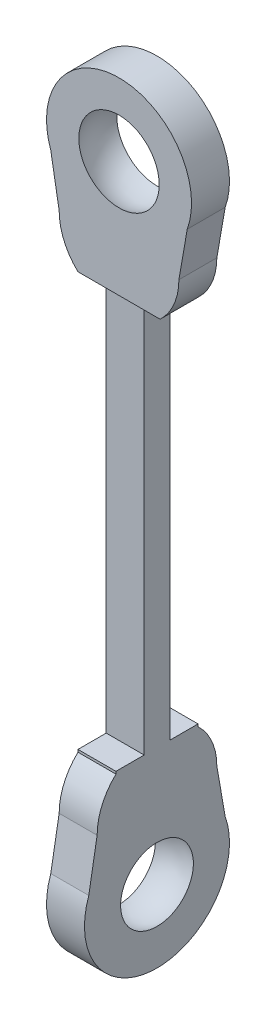
from build123d import *

# Parameters (mm, degrees)
SKETCH_1_R               = 3.532
SKETCH_1_R_2             = 2.165
EXTRUDE_1_DEPTH          = 2.849
EXTRUDE_START            = -2.849
EXTRUDE_3_DEPTH          = 2.849
EXTRUDE_4_DEPTH          = 2.849
SKETCH_5_W               = 4
SKETCH_5_H               = 8.802
EXTRUDE_5_DEPTH          = 2.849
EXTRUDE_6_DEPTH          = 2
EXTRUDE_6_DEPTH_BACK     = 2
SKETCH_11_R              = 2.165
SKETCH_12_W              = 1.376249561
SKETCH_12_H              = 19.360404774
SKETCH_12_W_2            = 1.095086679
CUT_EXTRUDE_1_DEPTH      = 24
CUT_EXTRUDE_2_DEPTH      = 24
CUT_EXTRUDE_2_DEPTH_BACK = 24
SKETCH_14_W              = 1.935032997
SKETCH_14_H              = 19.90949692
SKETCH_14_W_2            = 1.968594382
SKETCH_15_W              = 2.629097519
SKETCH_15_H              = 19.073490401
SKETCH_15_W_2            = 3.221303736
CUT_EXTRUDE_3_DEPTH      = 24
SKETCH_16_W              = 0.5
SKETCH_16_H              = 9.595959473
CUT_EXTRUDE_4_DEPTH      = 24
CUT_EXTRUDE_5_DEPTH      = 24
CUT_EXTRUDE_5_DEPTH_BACK = 24
SKETCH_17_W              = 1.075
SKETCH_17_H              = 30.344064149
SKETCH_19_R              = 2.165
EXTRUDE_7_DEPTH          = 1.849
SKETCH_21_R              = 2.165
EXTRUDE_9_DEPTH          = 1.85


with BuildPart() as part:
    # 草图1 → 凸台-拉伸1 (new body)
    with BuildSketch(Plane.XY):
        Circle(SKETCH_1_R)
        Circle(SKETCH_1_R_2, mode=Mode.SUBTRACT)
    extrude(amount=EXTRUDE_1_DEPTH)

    # 草图3 → 凸台-拉伸3 (add)
    with BuildSketch(Plane.XY.offset(2.849).offset(EXTRUDE_START)):
        with BuildLine():
            Line((-3.323475253, -1.195632151), (-2.916, -3.532))
            ThreePointArc((-2.916, -3.532), (0, -6.448), (2.916, -3.532))
            Line((2.916, -3.532), (3.323475253, -1.195632151))
            ThreePointArc((3.323475253, -1.195632151), (3.042882681, -1.79328999), (2.655959655, -2.328283126))
            ThreePointArc((2.655959655, -2.328283126), (-0.657357457, -3.470288918), (-3.323475253, -1.195632151))
        make_face()
    extrude(amount=EXTRUDE_3_DEPTH)

    # 草图4 → 凸台-拉伸4 (add)
    with BuildSketch(Plane.XY.offset(2.849).offset(EXTRUDE_START)):
        with BuildLine():
            ThreePointArc((2, -5.654040527), (1.075914918, -6.242251481), (0, -6.448))
            Line((0, -6.448), (2, -6.448))
            Line((2, -6.448), (2, -5.654040527))
        make_face()
        with BuildLine():
            Line((0, -6.448), (-2, -6.448))
            Line((-2, -6.448), (-2, -5.654040527))
            ThreePointArc((-2, -5.654040527), (-1.075914918, -6.242251481), (0, -6.448))
        make_face()
    extrude(amount=EXTRUDE_4_DEPTH)

    # 草图5 → 凸台-拉伸5 (add)
    with BuildSketch(Plane.XY.offset(2.849)):
        with Locations((0, -10.849)):
            Rectangle(SKETCH_5_W, SKETCH_5_H)
    extrude(amount=-EXTRUDE_5_DEPTH)

    # 草图11 → 凸台-拉伸6 (add, two sides: drawn at the far end of the back side and taken through both)
    with BuildSketch(Plane.ZY.offset(-EXTRUDE_6_DEPTH_BACK)):
        with BuildLine():
            Line((4.747975253, -29.304367849), (4.3405, -26.968))
            ThreePointArc((4.3405, -26.968), (4.101723935, -25.812349534), (3.4245, -24.845959473))
            Line((3.4245, -24.845959473), (3.4245, -15.25))
            Line((3.4245, -15.25), (-0.5755, -15.25))
            Line((-0.5755, -15.25), (-0.5755, -24.845959473))
            ThreePointArc((-0.5755, -24.845959473), (-1.252723935, -25.812349534), (-1.4915, -26.968))
            Line((-1.4915, -26.968), (-1.898975253, -29.304367849))
            ThreePointArc((-1.898975253, -29.304367849), (1.4245, -34.032), (4.747975253, -29.304367849))
        make_face()
        with Locations((1.4245, -30.5)):
            Circle(SKETCH_11_R, mode=Mode.SUBTRACT)
    extrude(amount=EXTRUDE_6_DEPTH + EXTRUDE_6_DEPTH_BACK)

    # 草图12 → 切除-拉伸1 (cut)
    with BuildSketch(Plane.ZY.offset(12)):
        with Locations((-0.188124781, -5.556058724)):
            Rectangle(SKETCH_12_W, SKETCH_12_H)
        with Locations((2.896543339, -5.556058724)):
            Rectangle(SKETCH_12_W_2, SKETCH_12_H)
    extrude(amount=-CUT_EXTRUDE_1_DEPTH, mode=Mode.SUBTRACT)

    # 草图14 → 切除-拉伸2 (cut, two sides: drawn at the far end of the back side and taken through both)
    with BuildSketch(Plane.XY.offset(3.4245).offset(-CUT_EXTRUDE_2_DEPTH_BACK)):
        with Locations((-2.467516499, -25.20474846)):
            Rectangle(SKETCH_14_W, SKETCH_14_H)
        with Locations((2.484297191, -25.20474846)):
            Rectangle(SKETCH_14_W_2, SKETCH_14_H)
    extrude(amount=CUT_EXTRUDE_2_DEPTH + CUT_EXTRUDE_2_DEPTH_BACK, mode=Mode.SUBTRACT)

    # 草图15 → 切除-拉伸3 (cut)
    with BuildSketch(Plane.ZY.offset(12)):
        with Locations((-0.51454876, -15.190785727)):
            Rectangle(SKETCH_15_W, SKETCH_15_H)
        with Locations((3.659651868, -15.190785727)):
            Rectangle(SKETCH_15_W_2, SKETCH_15_H)
    extrude(amount=-CUT_EXTRUDE_3_DEPTH, mode=Mode.SUBTRACT)

    # 草图16 → 切除-拉伸4 (cut)
    with BuildSketch(Plane(origin=(0, 0, 0.8), x_dir=(-1, 0, 0), z_dir=(0, 0, -1))):
        with Locations((-1.75, -10.452020264)):
            Rectangle(SKETCH_16_W, SKETCH_16_H)
        with Locations((1.75, -10.452020264)):
            Rectangle(SKETCH_16_W, SKETCH_16_H)
    extrude(amount=-CUT_EXTRUDE_4_DEPTH, mode=Mode.SUBTRACT)

    # 草图17 → 切除-拉伸5 (cut, two sides: drawn at the far end of the back side and taken through both)
    with BuildSketch(Plane.XY.offset(2.049).offset(-CUT_EXTRUDE_5_DEPTH_BACK)):
        with Locations((-1.4625, -20.826072602)):
            Rectangle(SKETCH_17_W, SKETCH_17_H)
        with Locations((1.4625, -20.826072602)):
            Rectangle(SKETCH_17_W, SKETCH_17_H)
    extrude(amount=CUT_EXTRUDE_5_DEPTH + CUT_EXTRUDE_5_DEPTH_BACK, mode=Mode.SUBTRACT)

    # 草图19 → 凸台-拉伸7 (add)
    with BuildSketch(Plane(origin=(0, 0, 0.5), x_dir=(-1, 0, 0), z_dir=(0, 0, -1))):
        Circle(SKETCH_19_R)
    extrude(amount=-EXTRUDE_7_DEPTH)

    # 草图18 → 切除-旋转3 (revolve, cut)
    with BuildSketch(Plane(origin=(0, 0, 1.4245), x_dir=(-1, 0, 0), z_dir=(0, 0, -1))):
        with BuildLine():
            Line((0, 2.165), (0, -2.165))
            ThreePointArc((0, -2.165), (-2.165, 0), (0, 2.165))
        make_face()
    revolve(axis=Axis((0, 2.165, 1.4245), (0, -1, 0)), mode=Mode.SUBTRACT)

    # 草图21 → 凸台-拉伸9 (add)
    with BuildSketch(Plane(origin=(0.925, 0, 0), x_dir=(0, 0, -1), z_dir=(1, 0, 0))):
        with Locations((-1.4245, -30.5)):
            Circle(SKETCH_21_R)
    extrude(amount=-EXTRUDE_9_DEPTH)

    # 草图22 → 切除-旋转4 (revolve, cut)
    with BuildSketch(Plane.ZY):
        with BuildLine():
            Line((1.4245, -28.5), (1.4245, -32.5))
            ThreePointArc((1.4245, -32.5), (-0.5755, -30.5), (1.4245, -28.5))
        make_face()
    revolve(axis=Axis((0, -28.5, 1.4245), (0, -1, 0)), mode=Mode.SUBTRACT)


solid = part.part
